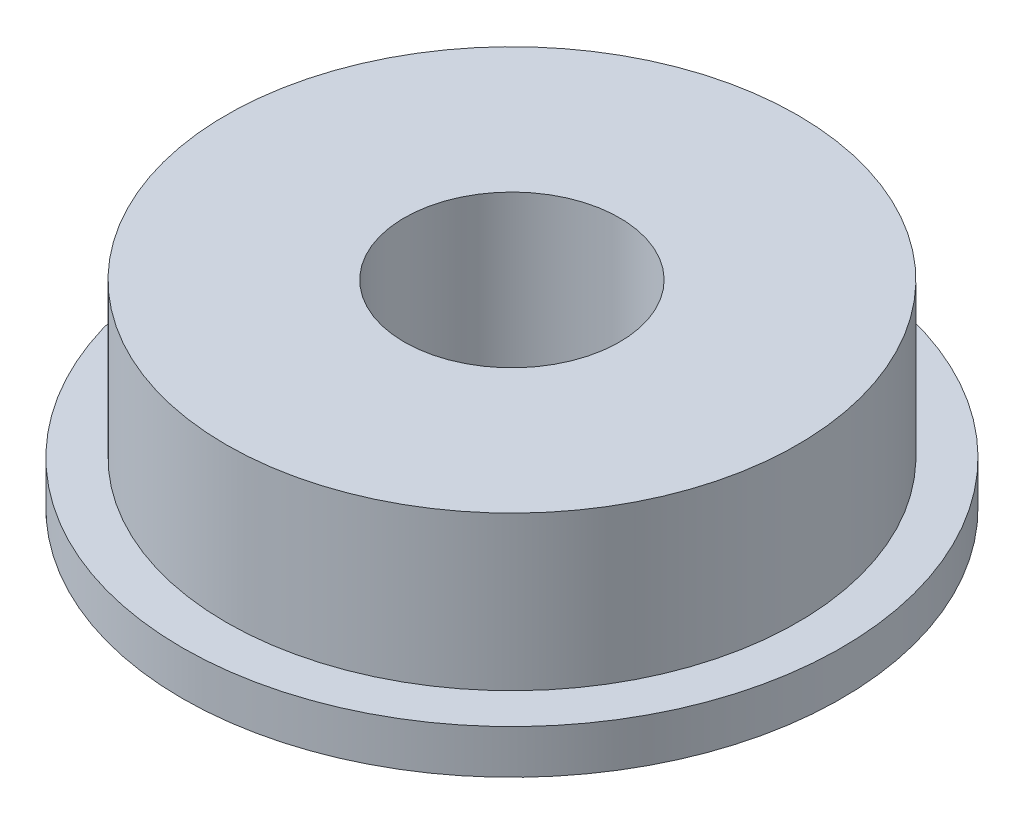
from build123d import *

# Parameters (mm, degrees)
SKETCH1_R           = 7.5
BOSS_EXTRUDE1_DEPTH = 1
SKETCH2_R           = 6.5
BOSS_EXTRUDE2_DEPTH = 3.5
SKETCH3_R           = 2.45
CUT_EXTRUDE1_DEPTH  = 4.5


with BuildPart() as part:
    # Sketch1 → Boss-Extrude1 (new body)
    with BuildSketch(Plane(origin=(0, 0, 0), x_dir=(1, 0, 0), z_dir=(0, 1, 0))):
        with Locations(Location((0, 0, 0), (0, 0, 270))):
            Circle(SKETCH1_R)
    extrude(amount=BOSS_EXTRUDE1_DEPTH)

    # Sketch2 → Boss-Extrude2 (add)
    with BuildSketch(Plane(origin=(0, 1, 0), x_dir=(1, 0, 0), z_dir=(0, 1, 0))):
        with Locations(Location((0, 0, 0), (0, 0, 270))):
            Circle(SKETCH2_R)
    extrude(amount=BOSS_EXTRUDE2_DEPTH)

    # Sketch3 → Cut-Extrude1 (cut)
    with BuildSketch(Plane(origin=(0, 4.5, 0), x_dir=(1, 0, 0), z_dir=(0, 1, 0))):
        with Locations(Location((0, 0, 0), (0, 0, 270))):
            Circle(SKETCH3_R)
    extrude(amount=-CUT_EXTRUDE1_DEPTH, mode=Mode.SUBTRACT)


solid = part.part
